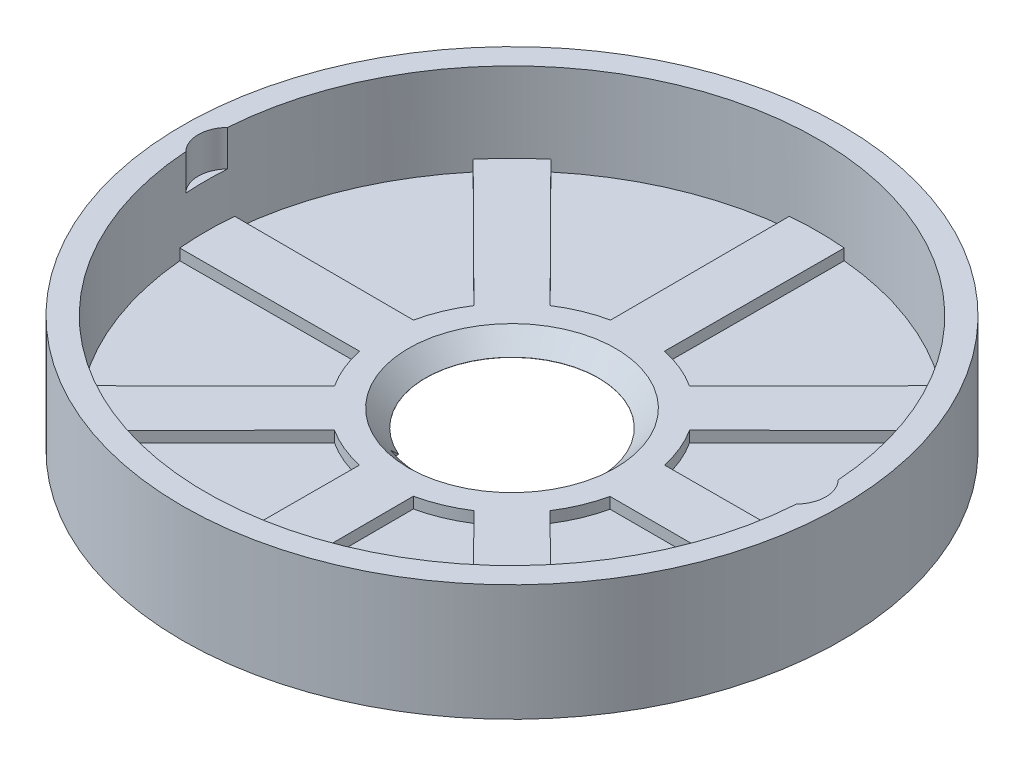
from build123d import *

# Parameters (mm, degrees)
SKETCH1_R           = 49.0728
SKETCH1_R_2         = 45.5676
EXTRUDE_THIN1_DEPTH = 17.3482
SKETCH2_R           = 18.9103
BOSS_EXTRUDE1_DEPTH = 2.8702
SKETCH3_R           = 48.26
SKETCH3_R_2         = 12.8778
BOSS_EXTRUDE2_DEPTH = 2.5654
CHAMFER1_SIZE       = 2.54
SKETCH4_W           = 10.0838
SKETCH4_H           = 6.023980684
CUT_EXTRUDE1_DEPTH  = 1.0668
CUT_EXTRUDE2_START  = -1.651
CUT_EXTRUDE2_DEPTH  = 1.651
CUT_EXTRUDE3_DEPTH  = 5.3594


with BuildPart() as part:
    # Sketch1 → Extrude-Thin1 (new body)
    with BuildSketch(Plane(origin=(0, 0, 0), x_dir=(1, 0, 0), z_dir=(0, 1, 0))):
        Circle(SKETCH1_R)
        Circle(SKETCH1_R_2, mode=Mode.SUBTRACT)
    extrude(amount=EXTRUDE_THIN1_DEPTH)



with BuildPart() as body_2:
    # Sketch2 → Boss-Extrude1 (new body)
    with BuildSketch(Plane.XZ):
        with BuildLine():
            Line((-1.9558, 45.525608355), (-1.9558, 22.865407444))
            ThreePointArc((-1.9558, 22.865407444), (-7.091600102, 21.825700887), (-11.857673846, 19.648093602))
            Line((-11.857673846, 19.648093602), (-25.177005755, 37.980581235))
            ThreePointArc((-25.177005755, 37.980581235), (-26.783963262, 36.864962793), (-28.34155663, 35.681400442))
            Line((-28.34155663, 35.681400442), (-15.022224721, 17.348912809))
            ThreePointArc((-15.022224721, 17.348912809), (-18.566050102, 13.489024976), (-21.14191931, 8.925875818))
            Line((-21.14191931, 8.925875818), (-42.693051047, 15.928262996))
            ThreePointArc((-42.693051047, 15.928262996), (-43.337362912, 14.081162793), (-43.901801922, 12.208110326))
            Line((-43.901801922, 12.208110326), (-22.350670185, 5.205723149))
            ThreePointArc((-22.350670185, 5.205723149), (-22.9489, 0), (-22.350670185, -5.205723149))
            Line((-22.350670185, -5.205723149), (-43.901801922, -12.208110326))
            ThreePointArc((-43.901801922, -12.208110326), (-43.337362912, -14.081162793), (-42.693051047, -15.928262996))
            Line((-42.693051047, -15.928262996), (-21.14191931, -8.925875818))
            ThreePointArc((-21.14191931, -8.925875818), (-18.566050102, -13.489024976), (-15.022224721, -17.348912809))
            Line((-15.022224721, -17.348912809), (-28.34155663, -35.681400442))
            ThreePointArc((-28.34155663, -35.681400442), (-26.783963262, -36.864962793), (-25.177005755, -37.980581235))
            Line((-25.177005755, -37.980581235), (-11.857673846, -19.648093602))
            ThreePointArc((-11.857673846, -19.648093602), (-7.091600102, -21.825700887), (-1.9558, -22.865407444))
            Line((-1.9558, -22.865407444), (-1.9558, -45.525608355))
            ThreePointArc((-1.9558, -45.525608355), (0, -45.5676), (1.9558, -45.525608355))
            Line((1.9558, -45.525608355), (1.9558, -22.865407444))
            ThreePointArc((1.9558, -22.865407444), (7.091600102, -21.825700887), (11.857673846, -19.648093602))
            Line((11.857673846, -19.648093602), (25.177005755, -37.980581235))
            ThreePointArc((25.177005755, -37.980581235), (26.783963262, -36.864962793), (28.34155663, -35.681400442))
            Line((28.34155663, -35.681400442), (15.022224721, -17.348912809))
            ThreePointArc((15.022224721, -17.348912809), (18.566050102, -13.489024976), (21.14191931, -8.925875818))
            Line((21.14191931, -8.925875818), (42.693051047, -15.928262996))
            ThreePointArc((42.693051047, -15.928262996), (43.337362912, -14.081162793), (43.901801922, -12.208110326))
            Line((43.901801922, -12.208110326), (22.350670185, -5.205723149))
            ThreePointArc((22.350670185, -5.205723149), (22.9489, 0), (22.350670185, 5.205723149))
            Line((22.350670185, 5.205723149), (43.901801922, 12.208110326))
            ThreePointArc((43.901801922, 12.208110326), (43.337362912, 14.081162793), (42.693051047, 15.928262996))
            Line((42.693051047, 15.928262996), (21.14191931, 8.925875818))
            ThreePointArc((21.14191931, 8.925875818), (18.566050102, 13.489024976), (15.022224721, 17.348912809))
            Line((15.022224721, 17.348912809), (28.34155663, 35.681400442))
            ThreePointArc((28.34155663, 35.681400442), (26.783963262, 36.864962793), (25.177005755, 37.980581235))
            Line((25.177005755, 37.980581235), (11.857673846, 19.648093602))
            ThreePointArc((11.857673846, 19.648093602), (7.091600102, 21.825700887), (1.9558, 22.865407444))
            Line((1.9558, 22.865407444), (1.9558, 45.525608355))
            ThreePointArc((1.9558, 45.525608355), (0, 45.5676), (-1.9558, 45.525608355))
        make_face()
        Circle(SKETCH2_R, mode=Mode.SUBTRACT)
    extrude(amount=-BOSS_EXTRUDE1_DEPTH)


with BuildPart() as part_1:
    add(part.part)

    add(body_2.part)  # Boss-Extrude2 merges body 2
    # Sketch3 → Boss-Extrude2 (add)
    with BuildSketch(Plane(origin=(0, 2.8702, 0), x_dir=(1, 0, 0), z_dir=(0, 1, 0))):
        Circle(SKETCH3_R)
        Circle(SKETCH3_R_2, mode=Mode.SUBTRACT)
    extrude(amount=BOSS_EXTRUDE2_DEPTH)

    # Chamfer1
    chamfer1_edges = [part_1.edges().sort_by_distance(p)[0] for p in [
        (-12.8778, 5.4356, 0),
    ]]
    chamfer(chamfer1_edges, length=CHAMFER1_SIZE)

    # Sketch4 → Cut-Extrude1 (cut)
    with BuildSketch(Plane.XZ.offset(-2.8702)):
        with Locations((0, 14.323509658)):
            Rectangle(SKETCH4_W, SKETCH4_H)
    extrude(amount=-CUT_EXTRUDE1_DEPTH, mode=Mode.SUBTRACT)

    # Sketch6 → Cut-Extrude2 (cut)
    with BuildSketch(Plane(origin=(0, 5.4356, 0), x_dir=(1, 0, 0), z_dir=(0, 1, 0)).offset(CUT_EXTRUDE2_START)):
        with BuildLine():
            Line((-4.0132, 18.6944), (-4.088878764, 45.38377728))
            ThreePointArc((-4.088878764, 45.38377728), (-17.437965573, 42.098972986), (-29.19990277, 34.982450572))
            Line((-29.19990277, 34.982450572), (-10.381176076, 16.056697944))
            ThreePointArc((-10.381176076, 16.056697944), (-7.317026971, 17.664865749), (-4.0132, 18.6944))
        make_face()
        with BuildLine():
            ThreePointArc((29.19990277, 34.982450572), (17.437965573, 42.098972986), (4.088878764, 45.38377728))
            Line((4.088878764, 45.38377728), (4.0132, 18.6944))
            ThreePointArc((4.0132, 18.6944), (7.317026971, 17.664865749), (10.381176076, 16.056697944))
            Line((10.381176076, 16.056697944), (29.19990277, 34.982450572))
        make_face()
        with BuildLine():
            ThreePointArc((-18.6944, 4.0132), (-17.664865749, 7.317026971), (-16.056697944, 10.381176076))
            Line((-16.056697944, 10.381176076), (-34.982450572, 29.19990277))
            ThreePointArc((-34.982450572, 29.19990277), (-42.098972986, 17.437965573), (-45.38377728, 4.088878764))
            Line((-45.38377728, 4.088878764), (-18.6944, 4.0132))
        make_face()
        with BuildLine():
            Line((34.982450572, 29.19990277), (16.056697944, 10.381176076))
            ThreePointArc((16.056697944, 10.381176076), (17.664865749, 7.317026971), (18.6944, 4.0132))
            Line((18.6944, 4.0132), (45.38377728, 4.088878764))
            ThreePointArc((45.38377728, 4.088878764), (42.098972986, 17.437965573), (34.982450572, 29.19990277))
        make_face()
        with BuildLine():
            ThreePointArc((-16.056697944, -10.381176076), (-17.664865749, -7.317026971), (-18.6944, -4.0132))
            Line((-18.6944, -4.0132), (-45.38377728, -4.088878764))
            ThreePointArc((-45.38377728, -4.088878764), (-42.098972986, -17.437965573), (-34.982450572, -29.19990277))
            Line((-34.982450572, -29.19990277), (-16.056697944, -10.381176076))
        make_face()
        with BuildLine():
            Line((45.383730316, -4.0894), (18.677879249, -4.0894))
            ThreePointArc((18.677879249, -4.0894), (17.649910049, -7.353029366), (16.056697944, -10.381176076))
            Line((16.056697944, -10.381176076), (34.982450572, -29.19990277))
            ThreePointArc((34.982450572, -29.19990277), (42.098872847, -17.438207328), (45.383730316, -4.0894))
        make_face()
        with BuildLine():
            ThreePointArc((-4.0132, -18.6944), (-7.317026971, -17.664865749), (-10.381176076, -16.056697944))
            Line((-10.381176076, -16.056697944), (-29.19990277, -34.982450572))
            ThreePointArc((-29.19990277, -34.982450572), (-17.437965573, -42.098972986), (-4.088878764, -45.38377728))
            Line((-4.088878764, -45.38377728), (-4.0132, -18.6944))
        make_face()
        with BuildLine():
            Line((29.19990277, -34.982450572), (10.381176076, -16.056697944))
            ThreePointArc((10.381176076, -16.056697944), (7.317026971, -17.664865749), (4.0132, -18.6944))
            Line((4.0132, -18.6944), (4.088878764, -45.38377728))
            ThreePointArc((4.088878764, -45.38377728), (17.437965573, -42.098972986), (29.19990277, -34.982450572))
        make_face()
    extrude(amount=CUT_EXTRUDE2_DEPTH, mode=Mode.SUBTRACT)

    # Sketch7 → Cut-Extrude3 (cut)
    with BuildSketch(Plane(origin=(0, 17.3482, 0), x_dir=(1, 0, 0), z_dir=(0, 1, 0))):
        with BuildLine():
            Line((-45.399557639, 3.175), (-45.399557639, -3.175))
            ThreePointArc((-45.399557639, -3.175), (-46.72329814, 0), (-45.399557639, 3.175))
        make_face()
        with BuildLine():
            Line((45.3995595, -3.175), (45.3995595, 3.175))
            ThreePointArc((45.3995595, 3.175), (46.7233, 0), (45.3995595, -3.175))
        make_face()
    extrude(amount=-CUT_EXTRUDE3_DEPTH, mode=Mode.SUBTRACT)


solid = part_1.part
